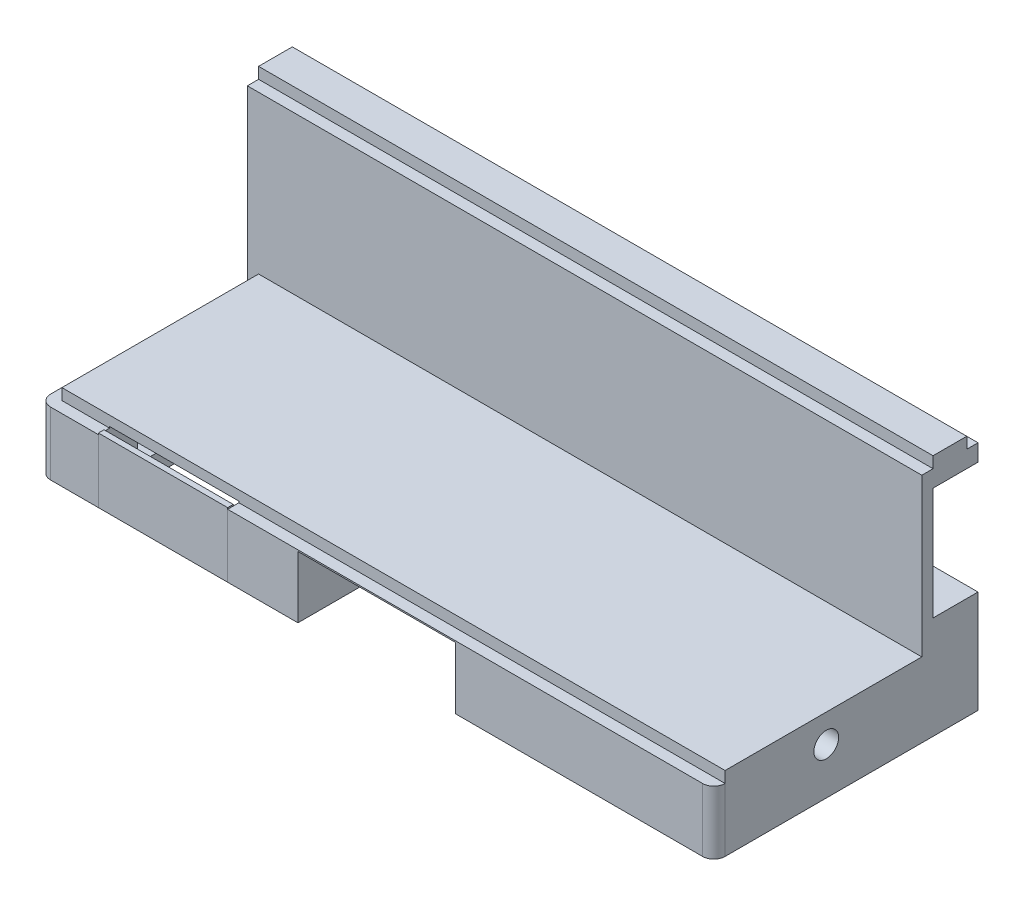
from build123d import *

# Parameters (mm, degrees)
SKETCH_1_W           = 120
SKETCH_1_H           = 47
EXTRUDE_1_DEPTH      = 15
SKETCH_2_W           = 120
SKETCH_2_H           = 10
EXTRUDE_2_DEPTH      = 30
SKETCH_3_W           = 28
SKETCH_3_H           = 10.5
CUT_EXTRUDE_1_DEPTH  = 619.029542744
SKETCH_4_W           = 23
SKETCH_4_H           = 11.5
CUT_EXTRUDE_2_DEPTH  = 619.029542744
SKETCH_5_W           = 23
SKETCH_5_H           = 11.5
EXTRUDE_3_DEPTH      = 1
CUT_EXTRUDE_4_DEPTH  = 8
SKETCH_8_W           = 4
SKETCH_8_H           = 5
CUT_EXTRUDE_5_DEPTH  = 40
EXTRUDE_5_DEPTH      = 3
FILLET_2_R           = 2
EXTRUDE_6_DEPTH      = 2
SKETCH_12_W          = 120
SKETCH_12_H          = 2
CUT_EXTRUDE_7_DEPTH  = 2
SKETCH_15_R          = 2.2
CUT_EXTRUDE_9_DEPTH  = 7
SKETCH_18_W          = 63.5
SKETCH_18_H          = 11
CUT_EXTRUDE_15_DEPTH = 8
SKETCH_20_W          = 28
SKETCH_20_H          = 0.5
CUT_EXTRUDE_16_DEPTH = 80
CUT_EXTRUDE_17_DEPTH = 8
SKETCH_22_W          = 11.736843269
SKETCH_22_H          = 11
CUT_EXTRUDE_18_DEPTH = 25
SKETCH_24_W          = 120
SKETCH_24_H          = 4
CUT_EXTRUDE_19_DEPTH = 2
SKETCH_25_W          = 23.28525444
SKETCH_25_H          = 36.187442056
CUT_EXTRUDE_20_DEPTH = 2
SKETCH_27_W          = 120.611710339
SKETCH_27_H          = 50.488927659
CUT_EXTRUDE_24_DEPTH = 1.75
SKETCH_28_W          = 3
SKETCH_28_H          = 15
EXTRUDE_7_DEPTH      = 1.5
CUT_EXTRUDE_25_DEPTH = 2
SKETCH_30_W          = 9
SKETCH_30_H          = 8
SKETCH_30_R          = 2.2
EXTRUDE_8_DEPTH      = 11
SKETCH_33_R          = 2.2
CUT_EXTRUDE_27_DEPTH = 5


with BuildPart() as part:
    # 草图1 → 凸台-拉伸1 (new body)
    with BuildSketch(Plane(origin=(0, 0, 0), x_dir=(1, 0, 0), z_dir=(0, 1, 0))):
        with Locations((-554.594594595, 301.635135135)):
            Rectangle(SKETCH_1_W, SKETCH_1_H)
    extrude(amount=EXTRUDE_1_DEPTH)

    # 草图2 → 凸台-拉伸2 (add)
    with BuildSketch(Plane(origin=(0, 15, 0), x_dir=(1, 0, 0), z_dir=(0, 1, 0))):
        with Locations((-554.594594595, 320.135135135)):
            Rectangle(SKETCH_2_W, SKETCH_2_H)
    extrude(amount=EXTRUDE_2_DEPTH)

    # 草图3 → 切除-拉伸1 (cut, through all)
    with BuildSketch(Plane.XY.offset(-278.135135135)):
        with Locations((-554.594594595, 7.5)):
            Rectangle(SKETCH_3_W, SKETCH_3_H)
    extrude(amount=-CUT_EXTRUDE_1_DEPTH, mode=Mode.SUBTRACT)

    # 草图4 → 切除-拉伸2 (cut, through all)
    with BuildSketch(Plane.XY.offset(-278.135135135)):
        with Locations((-592.594594595, 7.5)):
            Rectangle(SKETCH_4_W, SKETCH_4_H)
    extrude(amount=-CUT_EXTRUDE_2_DEPTH, mode=Mode.SUBTRACT)

    # 草图7 → 切除-拉伸4 (cut)
    with BuildSketch(Plane(origin=(0, 0, -325.135135135), x_dir=(-1, 0, 0), z_dir=(0, 0, -1))):
        with BuildLine():
            Line((494.594594595, 40), (509.594594595, 40))
            Line((509.594594595, 40), (509.594594595, 37.8))
            Line((509.594594595, 37.8), (579.544594595, 37.8))
            ThreePointArc((579.544594595, 37.8), (596.904066073, 30.609471478), (604.094594595, 13.25))
            Line((604.094594595, 13.25), (604.094594595, 12.75))
            Line((604.094594595, 12.75), (540.594594595, 12.75))
            ThreePointArc((540.594594595, 12.75), (537.826753677, 19.432159082), (531.144594595, 22.2))
            Line((531.144594595, 22.2), (509.594594595, 22.2))
            Line((509.594594595, 22.2), (509.594594595, 20))
            Line((509.594594595, 20), (494.594594595, 20))
            Line((494.594594595, 20), (494.594594595, 40))
        make_face()
    extrude(amount=-CUT_EXTRUDE_4_DEPTH, mode=Mode.SUBTRACT)

    # 草图8 → 切除-拉伸5 (cut)
    with BuildSketch(Plane(origin=(0, 0, -325.135135135), x_dir=(-1, 0, 0), z_dir=(0, 0, -1))):
        with Locations((606.094594595, 7.5)):
            Rectangle(SKETCH_8_W, SKETCH_8_H)
        with Locations((579.094594595, 7.5)):
            Rectangle(SKETCH_8_W, SKETCH_8_H)
    extrude(amount=-CUT_EXTRUDE_5_DEPTH, mode=Mode.SUBTRACT)

    # 草图9 → 凸台-拉伸5 (add)
    with BuildSketch(Plane(origin=(0, 0, -325.135135135), x_dir=(-1, 0, 0), z_dir=(0, 0, -1))):
        Polygon((540.594594595, 2.25), (546.794594595, 2.25), (546.794594595, 10.25), (562.394594595, 10.25), (562.394594595, 2.25), (568.594594595, 2.25), (568.594594595, 10.25), (568.594594595, 12.75), (540.594594595, 12.75), (540.594594595, 10.25), align=None)
    extrude(amount=-EXTRUDE_5_DEPTH)

    # 圆角2
    fillet_2_edges = [part.edges().sort_by_distance(p)[0] for p in [
        (-509.594594595, 40, -321.135135135),
        (-509.594594595, 20, -321.135135135),
        (-494.594594595, 7.5, -278.135135135),
        (-614.594594595, 7.5, -278.135135135),
    ]]
    fillet(fillet_2_edges, radius=FILLET_2_R)

    # 草图10 → 凸台-拉伸6 (add)
    with BuildSketch(Plane.XZ):
        Polygon((-494.594594595, -325.135135135), (-494.594594595, -321.135135135), (-544.594594595, -321.135135135), (-544.594594595, -288.135135135), (-564.594594595, -288.135135135), (-564.594594595, -321.135135135), (-614.594594595, -321.135135135), (-614.594594595, -325.135135135), align=None)
    extrude(amount=EXTRUDE_6_DEPTH)

    # 草图12 → 切除-拉伸7 (cut)
    with BuildSketch(Plane(origin=(0, 45, 0), x_dir=(1, 0, 0), z_dir=(0, 1, 0))):
        with Locations((-554.594594595, 324.135135135)):
            Rectangle(SKETCH_12_W, SKETCH_12_H)
        with Locations((-554.594594595, 316.135135135)):
            Rectangle(SKETCH_12_W, SKETCH_12_H)
    extrude(amount=-CUT_EXTRUDE_7_DEPTH, mode=Mode.SUBTRACT)

    # 草图15 → 切除-拉伸9 (cut)
    with BuildSketch(Plane.XZ):
        with Locations(Location((-574.594594595, -283.135135135, 0), (0, 0, 270))):
            Circle(SKETCH_15_R)
        with Locations(Location((-534.594594595, -283.135135135, 0), (0, 0, 270))):
            Circle(SKETCH_15_R)
    extrude(amount=-CUT_EXTRUDE_9_DEPTH, mode=Mode.SUBTRACT)

    # 草图18 → 切除-拉伸15 (cut)
    with BuildSketch(Plane(origin=(0, 0, -325.135135135), x_dir=(-1, 0, 0), z_dir=(0, 0, -1))):
        with Locations((572.344594595, 7.25)):
            Rectangle(SKETCH_18_W, SKETCH_18_H)
    extrude(amount=-CUT_EXTRUDE_15_DEPTH, mode=Mode.SUBTRACT)

    # 草图20 → 切除-拉伸16 (cut)
    with BuildSketch(Plane(origin=(0, 0, -317.135135135), x_dir=(-1, 0, 0), z_dir=(0, 0, -1))):
        with Locations((554.594594595, 2)):
            Rectangle(SKETCH_20_W, SKETCH_20_H)
    extrude(amount=-CUT_EXTRUDE_16_DEPTH, mode=Mode.SUBTRACT)

    # 草图21 → 切除-拉伸17 (cut)
    with BuildSketch(Plane(origin=(0, 0, -325.135135135), x_dir=(-1, 0, 0), z_dir=(0, 0, -1))):
        with BuildLine():
            Line((528.857751326, 12.75), (528.857751326, 1.75))
            Line((528.857751326, 1.75), (540.594594595, 1.75))
            Line((540.594594595, 1.75), (540.594594595, 12.75))
            ThreePointArc((540.594594595, 12.75), (537.826753677, 19.432159082), (531.144594595, 22.2))
            Line((531.144594595, 22.2), (519.407751326, 22.2))
            ThreePointArc((519.407751326, 22.2), (526.089910408, 19.432159082), (528.857751326, 12.75))
        make_face()
    extrude(amount=-CUT_EXTRUDE_17_DEPTH, mode=Mode.SUBTRACT)

    # 草图22 → 切除-拉伸18 (cut)
    with BuildSketch(Plane(origin=(0, 0, -317.135135135), x_dir=(-1, 0, 0), z_dir=(0, 0, -1))):
        with Locations((534.72617296, 7.25)):
            Rectangle(SKETCH_22_W, SKETCH_22_H)
    extrude(amount=-CUT_EXTRUDE_18_DEPTH, mode=Mode.SUBTRACT)

    # 草图24 → 切除-拉伸19 (cut)
    with BuildSketch(Plane.XZ.offset(2)):
        with Locations((-554.594594595, -323.135135135)):
            Rectangle(SKETCH_24_W, SKETCH_24_H)
    extrude(amount=-CUT_EXTRUDE_19_DEPTH, mode=Mode.SUBTRACT)

    # 草图25 → 切除-拉伸20 (cut)
    with BuildSketch(Plane.XZ.offset(2)):
        with Locations((-554.882611991, -305.107968522)):
            Rectangle(SKETCH_25_W, SKETCH_25_H)
    extrude(amount=-CUT_EXTRUDE_20_DEPTH, mode=Mode.SUBTRACT)

    # 草图27 → 切除-拉伸24 (cut)
    with BuildSketch(Plane.XZ):
        with Locations((-554.288739426, -299.890671306)):
            Rectangle(SKETCH_27_W, SKETCH_27_H)
    extrude(amount=-CUT_EXTRUDE_24_DEPTH, mode=Mode.SUBTRACT)

    # 草图28 → 凸台-拉伸7 (add)
    with BuildSketch(Plane(origin=(0, 0, -317.135135135), x_dir=(-1, 0, 0), z_dir=(0, 0, -1))):
        with Locations((527.094594595, 30.3)):
            Rectangle(SKETCH_28_W, SKETCH_28_H)
    extrude(amount=EXTRUDE_7_DEPTH)

    # 草图29 → 切除-拉伸25 (cut)
    with BuildSketch(Plane(origin=(0, 15, 0), x_dir=(1, 0, 0), z_dir=(0, 1, 0))):
        Polygon((-494.594594595, 280.135135135), (-612.594594595, 280.135135135), (-612.594594595, 315.135135135), (-614.594594595, 315.135135135), (-614.594594595, 280.135135135), (-614.594594595, 278.135135135), (-494.594594595, 278.135135135), align=None)
    extrude(amount=-CUT_EXTRUDE_25_DEPTH, mode=Mode.SUBTRACT)

    # 草图30 → 凸台-拉伸8 (add)
    with BuildSketch(Plane.XZ.offset(-12.75)):
        with Locations((-554.594594595, -313.135135135)):
            Rectangle(SKETCH_30_W, SKETCH_30_H)
        with Locations(Location((-554.594594595, -313.135135135, 0), (0, 0, 180))):
            Circle(SKETCH_30_R, mode=Mode.SUBTRACT)
    extrude(amount=EXTRUDE_8_DEPTH)

    # 草图33 → 切除-拉伸27 (cut)
    with BuildSketch(Plane(origin=(-494.594594595, 0, 0), x_dir=(0, 0, -1), z_dir=(1, 0, 0))):
        with Locations((298.135135135, 10)):
            Circle(SKETCH_33_R)
    extrude(amount=-CUT_EXTRUDE_27_DEPTH, mode=Mode.SUBTRACT)


with BuildPart() as body_2:
    # 草图5 → 凸台-拉伸3 (new body)
    with BuildSketch(Plane.XY.offset(-278.135135135)):
        with Locations((-592.594594595, 7.5)):
            Rectangle(SKETCH_5_W, SKETCH_5_H)
    extrude(amount=-EXTRUDE_3_DEPTH)


solid = Compound([part.part, body_2.part])
